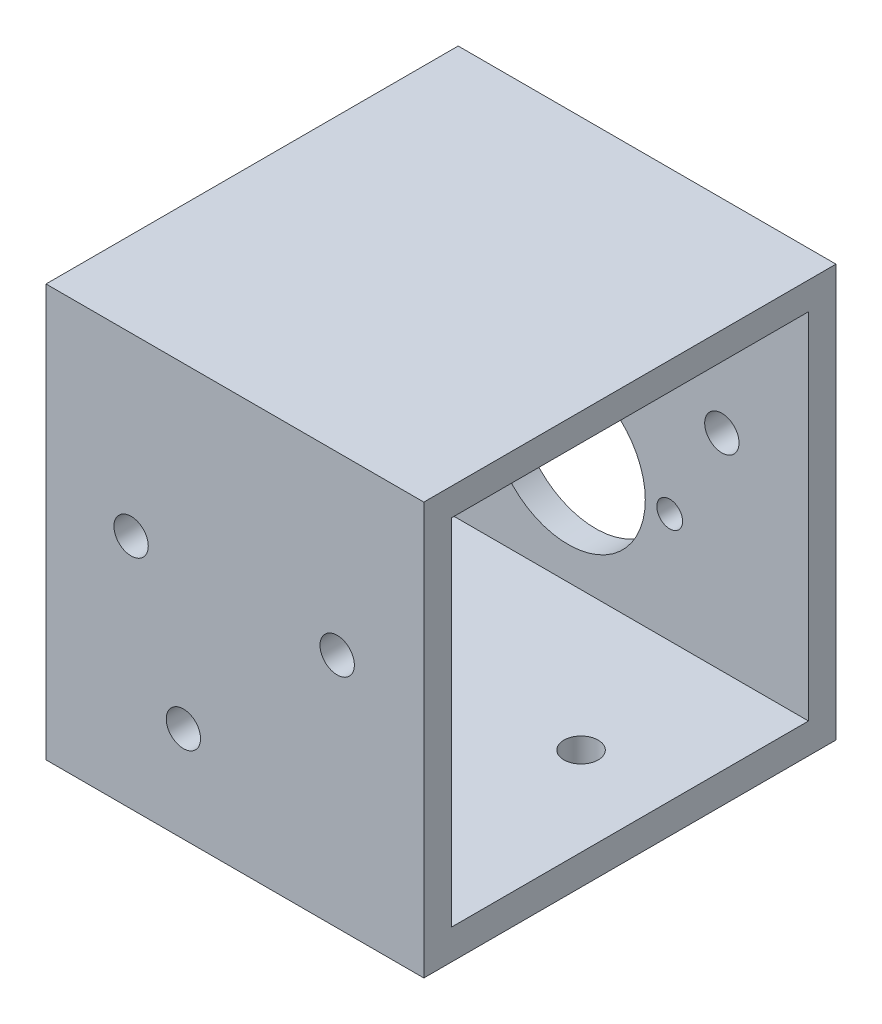
from build123d import *

# Parameters (mm, degrees)
BOSS_EXTRUDE1_DEPTH      = 3.81
BOSS_EXTRUDE1_DEPTH_BACK = 1.27
SKETCH1_R                = 14.2748
SKETCH1_R_2              = 2.3876
SKETCH1_R_3              = 3.175
SKETCH2_W                = 69.85
SKETCH2_H                = 5.08
BOSS_EXTRUDE2_DEPTH      = 66.04
SKETCH3_W                = 69.85
SKETCH3_H                = 5.588
BOSS_EXTRUDE3_DEPTH      = 66.04
SKETCH4_W                = 69.85
SKETCH4_H                = 76.2
SKETCH4_R                = 3.175
BOSS_EXTRUDE4_DEPTH      = 5.08
CUT_EXTRUDE1_REACH       = 117.744
SKETCH6_R                = 3.174999999
SKETCH8_R                = 3.175
CUT_EXTRUDE2_DEPTH       = 102.545692986


with BuildPart() as part:
    # Sketch1 → Boss-Extrude1 (new, two sides: drawn at the far end of the back side and taken through both)
    with BuildSketch(Plane.XY.offset(-BOSS_EXTRUDE1_DEPTH_BACK)):
        Polygon((-25.4, 43.942), (-25.4, 50.292), (44.45, 50.292), (44.45, 24.892), (44.45, -25.908), (-25.4, -25.908), align=None)
        Circle(SKETCH1_R, mode=Mode.SUBTRACT)
        with Locations((18.7833, 0)):
            Circle(SKETCH1_R_2, mode=Mode.SUBTRACT)
        with Locations((-18.7833, 0)):
            Circle(SKETCH1_R_2, mode=Mode.SUBTRACT)
        with Locations((28.430863033, 17.78)):
            Circle(SKETCH1_R_3, mode=Mode.SUBTRACT)
    extrude(amount=BOSS_EXTRUDE1_DEPTH + BOSS_EXTRUDE1_DEPTH_BACK)

    # Sketch2 → Boss-Extrude2 (add)
    with BuildSketch(Plane.XY.offset(3.81)):
        with Locations((9.525, 47.752)):
            Rectangle(SKETCH2_W, SKETCH2_H)
    extrude(amount=BOSS_EXTRUDE2_DEPTH)

    # Sketch3 → Boss-Extrude3 (add)
    with BuildSketch(Plane.XY.offset(3.81)):
        with Locations((9.525, -23.114)):
            Rectangle(SKETCH3_W, SKETCH3_H)
    extrude(amount=BOSS_EXTRUDE3_DEPTH)

    # Sketch4 → Boss-Extrude4 (add)
    with BuildSketch(Plane.XY.offset(69.85)):
        with Locations((9.525, 12.192)):
            Rectangle(SKETCH4_W, SKETCH4_H)
        with Locations((28.430863033, 17.78)):
            Circle(SKETCH4_R, mode=Mode.SUBTRACT)
        with Locations((0, -8.2296)):
            Circle(SKETCH4_R, mode=Mode.SUBTRACT)
    extrude(amount=BOSS_EXTRUDE4_DEPTH)

    # Sketch6 → Cut-Extrude1 (cut, up to next)
    with BuildSketch(Plane.XZ.offset(25.908), mode=Mode.PRIVATE) as cut_extrude1_sk1:
        with Locations(Location((28.068770575, 29.478784222, 0), (0, 0, 270))):
            Circle(SKETCH6_R)
    cut_extrude1_tool1 = extrude(cut_extrude1_sk1.sketch, amount=-CUT_EXTRUDE1_REACH, mode=Mode.PRIVATE) & part.part
    add(cut_extrude1_tool1.solids().sort_by_distance((28.068771, -25.908, 29.478784))[0], mode=Mode.SUBTRACT)

    # Sketch8 → Cut-Extrude2 (cut, through all)
    with BuildSketch(Plane.XY.offset(74.93)):
        with Locations((-9.669136967, 17.78)):
            Circle(SKETCH8_R)
    extrude(amount=-CUT_EXTRUDE2_DEPTH, mode=Mode.SUBTRACT)


solid = part.part
